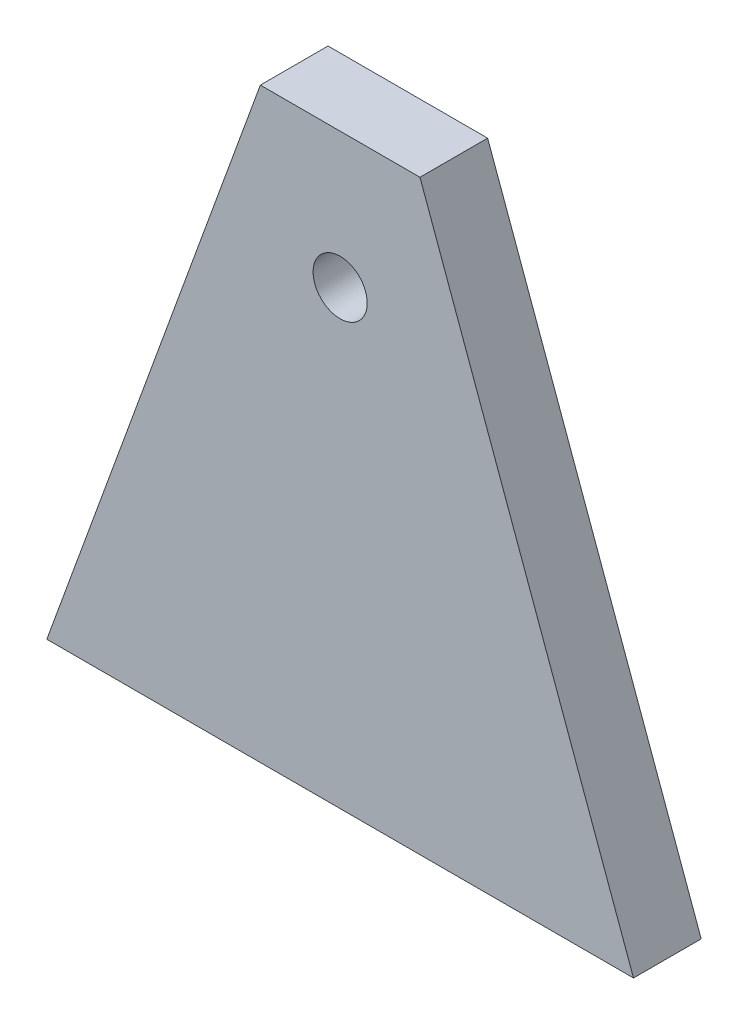
from build123d import *

# Parameters (mm, degrees)
RESSALTO_EXTRUS_O1_DEPTH = 15
ESBO_O2_R                = 6
CORTE_EXTRUS_O1_DEPTH    = 185.458667457


with BuildPart() as part:
    # Esboço1 → Ressalto-extrusão1 (new body)
    with BuildSketch(Plane.XY):
        Polygon((0, 0), (130, 0), (82.683869545, 130), (47.316130455, 130), align=None)
    extrude(amount=RESSALTO_EXTRUS_O1_DEPTH)

    # Esboço2 → Corte-extrusão1 (cut, through all)
    with BuildSketch(Plane.XY.offset(15)):
        with Locations((65, 100)):
            Circle(ESBO_O2_R)
    extrude(amount=-CORTE_EXTRUS_O1_DEPTH, mode=Mode.SUBTRACT)


solid = part.part
